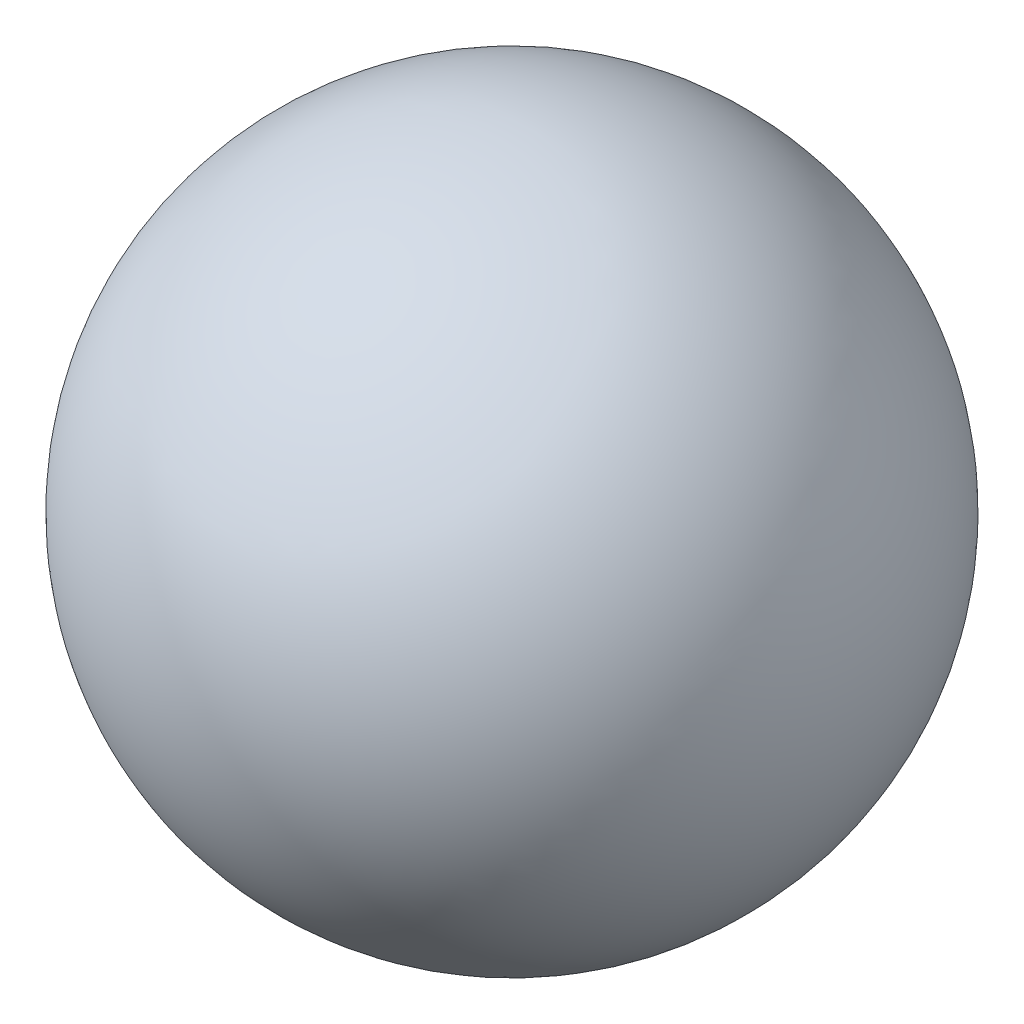
from build123d import *


with BuildPart() as part:
    # Sketch1 → Revolve-Thin1 (revolve)
    with BuildSketch(Plane(origin=(0, 0, 0), x_dir=(1, 0, 0), z_dir=(0, 1, 0))):
        with BuildLine():
            ThreePointArc((0, 29.570968784), (-29.570968784, 0), (0, -29.570968784))
            Line((0, -29.570968784), (0, -32.110968784))
            ThreePointArc((0, -32.110968784), (-32.110968784, 0), (0, 32.110968784))
            Line((0, 32.110968784), (0, 29.570968784))
        make_face()
    revolve(axis=Axis((0, 0, -29.570968784), (0, 0, 1)))


solid = part.part
